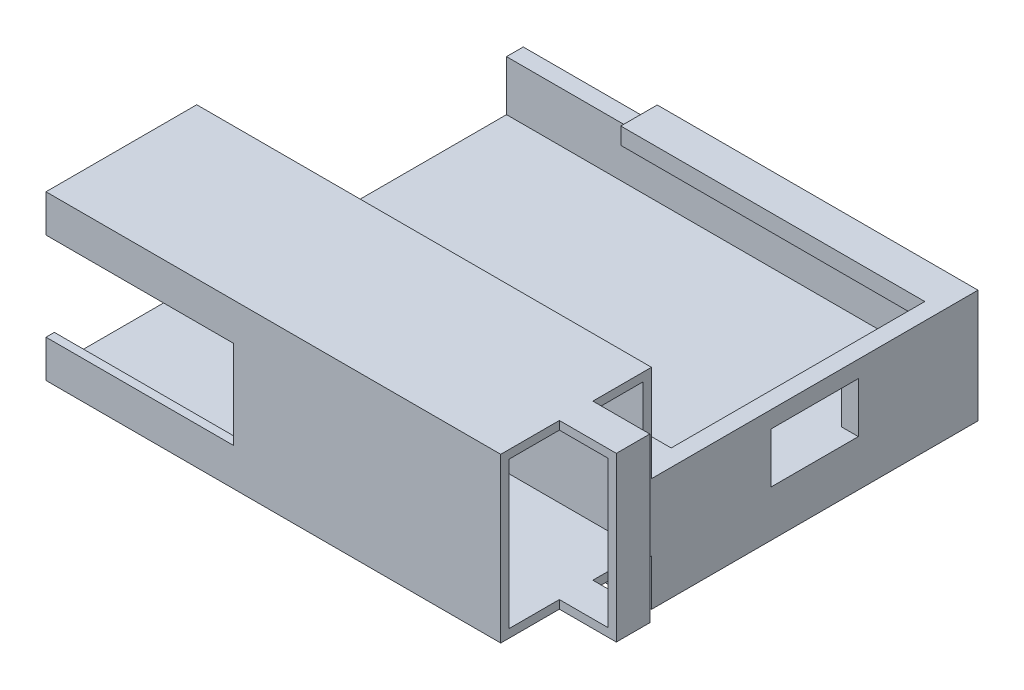
from build123d import *

# Parameters (mm, degrees)
BOSS_EXTRUDE1_DEPTH  = 83.0326
SKETCH2_W            = 61.8998
SKETCH2_H            = 21.463
BOSS_EXTRUDE2_DEPTH  = 3.175
SKETCH3_W            = 25.4
SKETCH3_H            = 5.08
CUT_EXTRUDE1_DEPTH   = 107.886039958
FILLET1_R            = 0.762
FILLET2_R            = 0.762
FILLET3_R            = 0.762
SKETCH5_W            = 16.529901782
SKETCH5_H            = 9.525
CUT_EXTRUDE2_DEPTH   = 90.51870739
SKETCH41_W           = 86.2076
SKETCH41_H           = 30.988
BOSS_EXTRUDE10_DEPTH = 1.5875
SKETCH42_W           = 86.2076
SKETCH42_H           = 1.5875
BOSS_EXTRUDE11_DEPTH = 25.4
SKETCH47_W           = 86.2076
SKETCH47_H           = 1.5875
BOSS_EXTRUDE13_DEPTH = 25.4
SKETCH48_W           = 86.2076
SKETCH48_H           = 30.988
BOSS_EXTRUDE14_DEPTH = 1.5875
SKETCH49_W           = 1.5875
SKETCH49_H           = 16.764
CUT_EXTRUDE5_DEPTH   = 35.56
SKETCH50_W           = 6.35
SKETCH50_H           = 1.5875
BOSS_EXTRUDE15_DEPTH = 9.2075
SKETCH52_W           = 6.35
SKETCH52_H           = 30.988
BOSS_EXTRUDE17_DEPTH = 1.5875
SKETCH53_W           = 25.4
SKETCH53_H           = 61.8998
CUT_EXTRUDE6_DEPTH   = 3.175


with BuildPart() as part:
    # Sketch1 → Boss-Extrude1 (new body)
    with BuildSketch(Plane(origin=(0, 0, 0), x_dir=(0, 0, -1), z_dir=(1, 0, 0))):
        Polygon((-27.7749, 9.525), (-24.0411, 9.525), (-24.0411, 12.7), (-30.9499, 12.7), (-30.9499, -3.175), (-30.9499, -8.763), (30.9499, -8.763), (30.9499, -3.175), (30.9499, 12.7), (24.0411, 12.7), (24.0411, 9.525), (27.7749, 9.525), (27.7749, 0), (-27.7749, 0), align=None)
    extrude(amount=BOSS_EXTRUDE1_DEPTH)

    # Sketch2 → Boss-Extrude2 (add)
    with BuildSketch(Plane(origin=(83.0326, 0, 0), x_dir=(0, 0, -1), z_dir=(1, 0, 0))):
        with Locations((0, 1.9685)):
            Rectangle(SKETCH2_W, SKETCH2_H)
    extrude(amount=BOSS_EXTRUDE2_DEPTH)

    # Sketch3 → Cut-Extrude1 (cut, through all)
    with BuildSketch(Plane.XY.offset(30.9499)):
        with Locations((24.0538, -4.815937668)):
            Rectangle(SKETCH3_W, SKETCH3_H)
        with Locations((62.1538, -4.815937668)):
            Rectangle(SKETCH3_W, SKETCH3_H)
    extrude(amount=-CUT_EXTRUDE1_DEPTH, mode=Mode.SUBTRACT)

    # Fillet1
    fillet1_edges = [part.edges().sort_by_distance(p)[0] for p in [
        (24.0538, -7.355937668, -30.9499),
        (24.0538, -7.355937668, 30.9499),
        (62.1538, -7.355937668, -30.9499),
        (62.1538, -7.355937668, 30.9499),
    ]]
    fillet(fillet1_edges, radius=FILLET1_R)

    # Fillet2
    fillet2_edges = [part.edges().sort_by_distance(p)[0] for p in [
        (11.3538, -5.196937668, -30.9499),
        (24.0538, -2.275937668, -30.9499),
        (36.7538, -5.196937668, -30.9499),
        (49.4538, -5.196937668, -30.9499),
        (62.1538, -2.275937668, -30.9499),
        (74.8538, -5.196937668, -30.9499),
    ]]
    fillet(fillet2_edges, radius=FILLET2_R)

    # Fillet3
    fillet3_edges = [part.edges().sort_by_distance(p)[0] for p in [
        (74.8538, -5.196937668, 30.9499),
        (62.1538, -2.275937668, 30.9499),
        (49.4538, -5.196937668, 30.9499),
        (11.3538, -5.196937668, 30.9499),
        (24.0538, -2.275937668, 30.9499),
        (36.7538, -5.196937668, 30.9499),
    ]]
    fillet(fillet3_edges, radius=FILLET3_R)

    # Sketch5 → Cut-Extrude2 (cut, through all)
    with BuildSketch(Plane.ZY.offset(-83.0326)):
        with Locations((0, 4.7625)):
            Rectangle(SKETCH5_W, SKETCH5_H)
    extrude(amount=-CUT_EXTRUDE2_DEPTH, mode=Mode.SUBTRACT)

    # Sketch41 → Boss-Extrude10 (add)
    with BuildSketch(Plane.XY.offset(30.9499)):
        with Locations((43.1038, 15.494)):
            Rectangle(SKETCH41_W, SKETCH41_H)
    extrude(amount=BOSS_EXTRUDE10_DEPTH)

    # Sketch42 → Boss-Extrude11 (add)
    with BuildSketch(Plane.XY.offset(32.5374)):
        with Locations((43.1038, 0.79375)):
            Rectangle(SKETCH42_W, SKETCH42_H)
    extrude(amount=BOSS_EXTRUDE11_DEPTH)

    # Sketch47 → Boss-Extrude13 (add)
    with BuildSketch(Plane.XY.offset(32.5374)):
        with Locations((43.1038, 30.19425)):
            Rectangle(SKETCH47_W, SKETCH47_H)
    extrude(amount=BOSS_EXTRUDE13_DEPTH)

    # Sketch48 → Boss-Extrude14 (add)
    with BuildSketch(Plane.XY.offset(57.9374)):
        with Locations((43.1038, 15.494)):
            Rectangle(SKETCH48_W, SKETCH48_H)
    extrude(amount=BOSS_EXTRUDE14_DEPTH)

    # Sketch49 → Cut-Extrude5 (cut)
    with BuildSketch(Plane.ZY):
        with Locations((58.73115, 15.494)):
            Rectangle(SKETCH49_W, SKETCH49_H)
    extrude(amount=-CUT_EXTRUDE5_DEPTH, mode=Mode.SUBTRACT)

    # Sketch50 → Boss-Extrude15 (add)
    with BuildSketch(Plane(origin=(86.2076, 0, 0), x_dir=(0, 0, -1), z_dir=(1, 0, 0))):
        with Locations((-45.2374, 30.19425)):
            Rectangle(SKETCH50_W, SKETCH50_H)
        with Locations((-45.2374, 0.79375)):
            Rectangle(SKETCH50_W, SKETCH50_H)
    extrude(amount=BOSS_EXTRUDE15_DEPTH)

    # Sketch52 → Boss-Extrude17 (add)
    with BuildSketch(Plane(origin=(95.4151, 0, 0), x_dir=(0, 0, -1), z_dir=(1, 0, 0))):
        with Locations((-45.2374, 15.494)):
            Rectangle(SKETCH52_W, SKETCH52_H)
    extrude(amount=BOSS_EXTRUDE17_DEPTH)

    # Sketch53 → Cut-Extrude6 (cut)
    with BuildSketch(Plane(origin=(0, 12.7, 0), x_dir=(1, 0, 0), z_dir=(0, 1, 0))):
        with Locations((12.7, 0)):
            Rectangle(SKETCH53_W, SKETCH53_H)
    extrude(amount=-CUT_EXTRUDE6_DEPTH, mode=Mode.SUBTRACT)


solid = part.part
